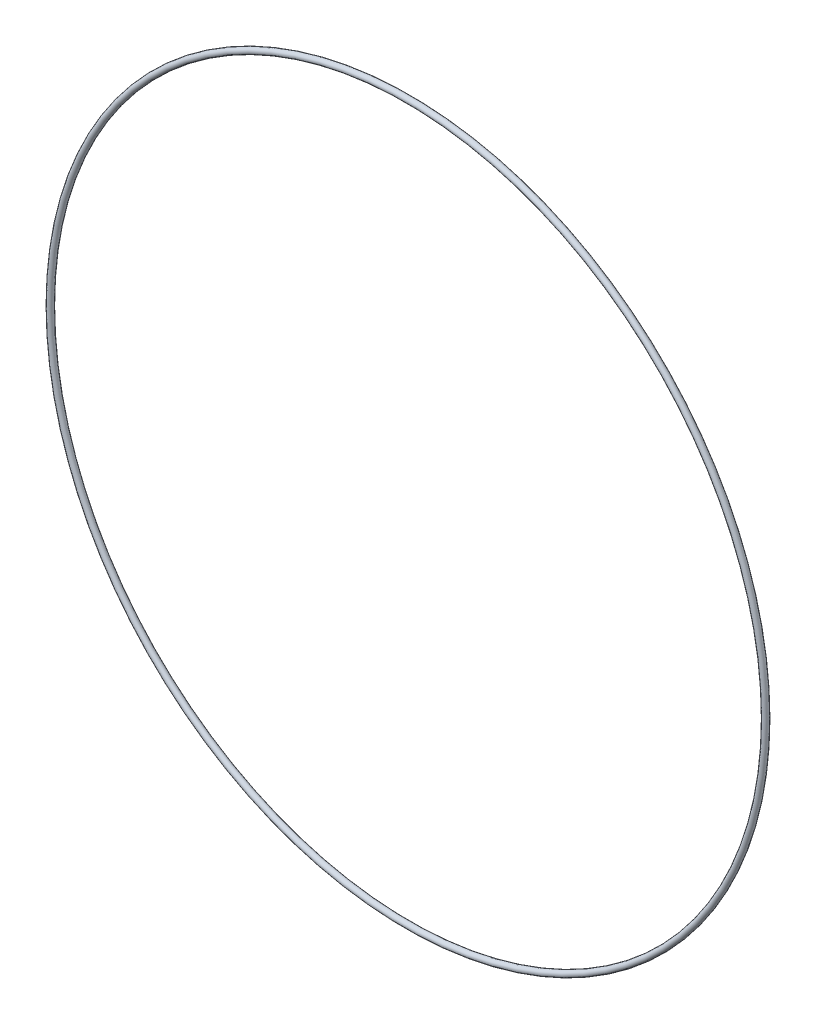
from build123d import *

# Parameters (mm, degrees)
SKETCH3_R = 1


with BuildPart() as part:
    # Sketch3 → Revolve1 (revolve)
    with BuildSketch(Plane(origin=(0, 0, 0), x_dir=(0, 0, -1), z_dir=(1, 0, 0)), mode=Mode.PRIVATE) as revolve1_sk:
        with Locations((0, 118)):
            Circle(SKETCH3_R)
    revolve(revolve1_sk.sketch.rotate(Axis((0, 0, 0), (0, 0, -1)), 90), axis=Axis((0, 0, 0), (0, 0, -1)))


solid = part.part
